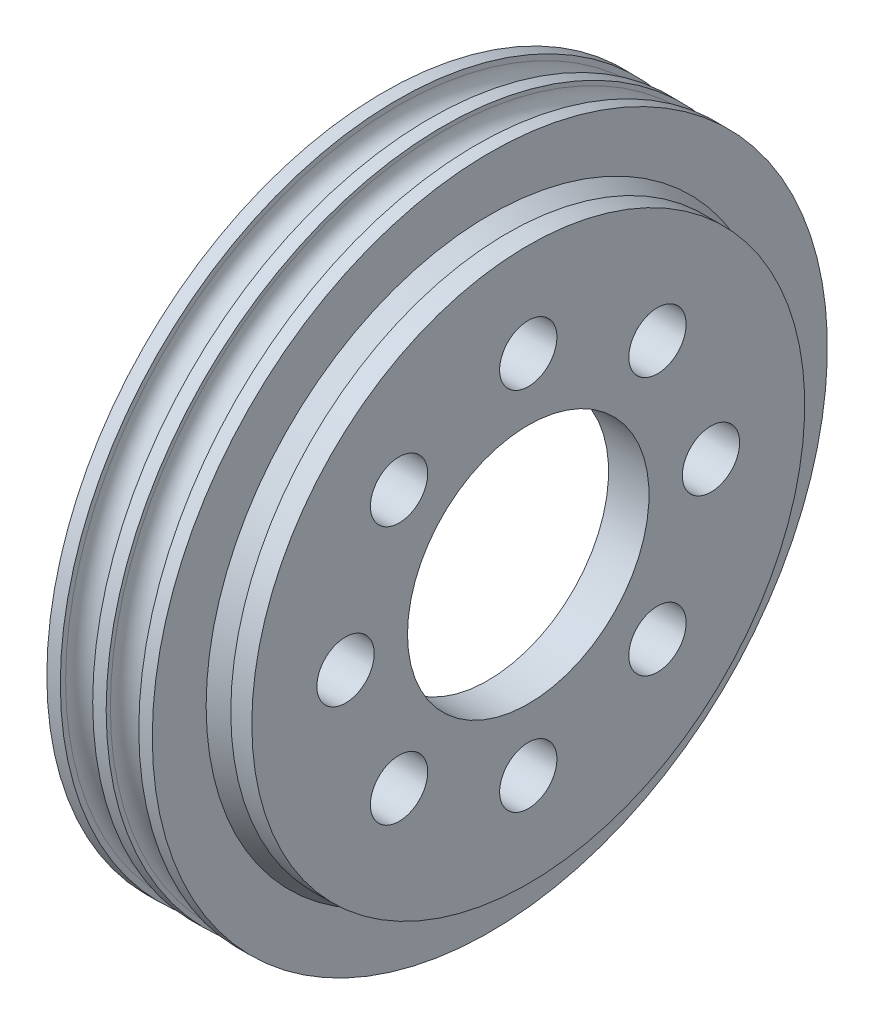
from build123d import *

# Parameters (mm, degrees)
SKETCH2_R          = 4.25
CUT_EXTRUDE1_DEPTH = 10


with BuildPart() as part:
    # Sketch1 → Revolve1 (revolve)
    with BuildSketch(Plane.XY, mode=Mode.PRIVATE) as revolve1_sk:
        with BuildLine():
            Line((1.256075941, 4.83169775), (1.256075941, -3.156564647))
            Line((1.256075941, -3.156564647), (3.835935187, -4.230222841))
            Line((3.835935187, -4.230222841), (6.956075941, -4.230222841))
            Line((6.956075941, -4.230222841), (6.956075941, -27.31830225))
            Line((6.956075941, -27.31830225), (0.956075941, -27.31830225))
            Line((0.956075941, -27.31830225), (0.956075941, -9.230222841))
            Line((0.956075941, -9.230222841), (-14.443924059, -1.328435893))
            Line((-14.443924059, -1.328435893), (-14.443924059, 4.769777159))
            Line((-14.443924059, 4.769777159), (-12.443924059, 4.769777159))
            Line((-12.443924059, 4.769777159), (-12.443924059, 3.983753219))
            ThreePointArc((-12.443924059, 3.983753219), (-10.043924059, 1.583753219), (-7.643924059, 3.983753219))
            Line((-7.643924059, 3.983753219), (-7.643924059, 4.769777159))
            Line((-7.643924059, 4.769777159), (-5.643924059, 4.769777159))
            Line((-5.643924059, 4.769777159), (-5.643924059, 4.15038965))
            ThreePointArc((-5.643924059, 4.15038965), (-3.193924059, 1.70038965), (-0.743924059, 4.15038965))
            Line((-0.743924059, 4.15038965), (-0.743924059, 4.83169775))
            Line((-0.743924059, 4.83169775), (1.256075941, 4.83169775))
        make_face()
    revolve(revolve1_sk.sketch.rotate(Axis((-24.757186567, -45.230222841, 0), (1, 0, 0)), 90), axis=Axis((-24.757186567, -45.230222841, 0), (1, 0, 0)))

    # Sketch2 → Cut-Extrude1 (cut)
    with BuildSketch(Plane.ZY.offset(-0.956075941)):
        with Locations((0, -18.130222841)):
            Circle(SKETCH2_R)
        with Locations((19.16259377, -26.067629071)):
            Circle(SKETCH2_R)
        with Locations((27.1, -45.230222841)):
            Circle(SKETCH2_R)
        with Locations((19.16259377, -64.392816611)):
            Circle(SKETCH2_R)
        with Locations((0, -72.330222841)):
            Circle(SKETCH2_R)
        with Locations((-19.16259377, -64.392816611)):
            Circle(SKETCH2_R)
        with Locations((-27.1, -45.230222841)):
            Circle(SKETCH2_R)
        with Locations((-19.16259377, -26.067629071)):
            Circle(SKETCH2_R)
    extrude(amount=-CUT_EXTRUDE1_DEPTH, mode=Mode.SUBTRACT)


solid = part.part
